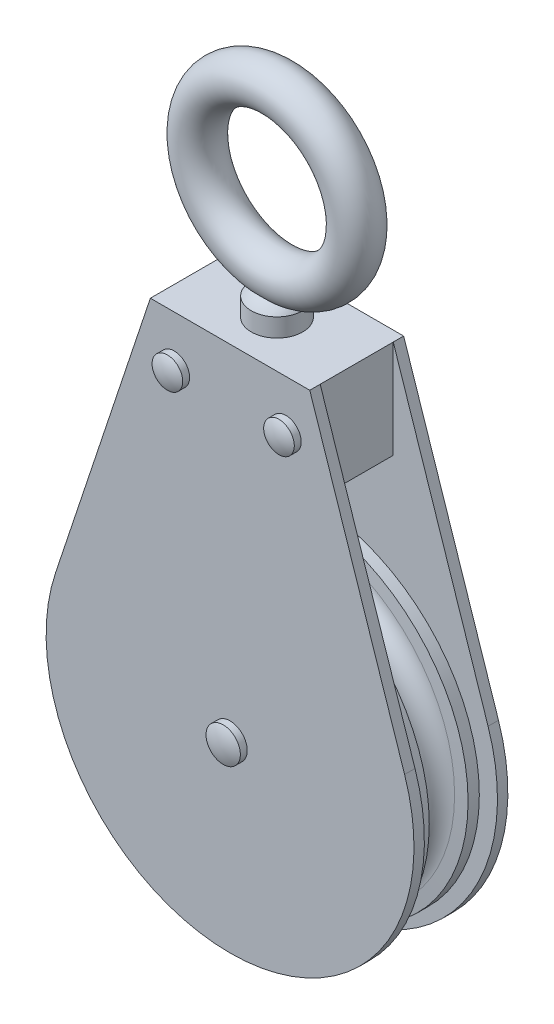
from build123d import *

# Parameters (mm, degrees)
SKETCH10_R          = 5.55625
BOSS_EXTRUDE1_DEPTH = 2.6924
SKETCH5_W           = 41.275
SKETCH5_H           = 25.4
BOSS_EXTRUDE2_DEPTH = 9.4615
SKETCH6_R           = 4.445
SKETCH6_R_2         = 3.96875
BOSS_EXTRUDE3_DEPTH = 1.778
DOME1_FACE_RADIUS   = 3.96875
DOME1_HEIGHT        = 1.016
DOME3_FACE_RADIUS   = 3.96875
DOME3_HEIGHT        = 1.016
DOME4_FACE_RADIUS   = 4.445
DOME4_HEIGHT        = 1.016
SKETCH8_R           = 5.55625
SKETCH8_R_2         = 7.9375
BOSS_EXTRUDE4_DEPTH = 1.778
DOME5_FACE_RADIUS   = 5.55625
DOME5_HEIGHT        = 2.54
DOME6_FACE_RADIUS   = 5.55625
DOME6_HEIGHT        = 2.54
DOME7_FACE_RADIUS   = 7.9375
DOME7_HEIGHT        = 3.9624
BOSS_EXTRUDE5_REACH = 158.53
SKETCH9_R           = 3.57505
SKETCH15_R          = 6.6675
BOSS_EXTRUDE6_DEPTH = 4.064
FILLET1_R           = 2.032


with BuildPart() as part:
    # Sketch3 → Revolve1 (revolve)
    with BuildSketch(Plane(origin=(0, 0, 0), x_dir=(0, 0, -1), z_dir=(1, 0, 0)), mode=Mode.PRIVATE) as revolve1_sk:
        with BuildLine():
            Line((-7.9375, 44.45), (-7.9375, 0))
            Line((-7.9375, 0), (7.9375, 0))
            Line((7.9375, 0), (7.9375, 44.45))
            Line((7.9375, 44.45), (5.025135302, 44.45))
            Line((5.025135302, 44.45), (4.74437725, 41.240920775))
            ThreePointArc((4.74437725, 41.240920775), (0, 36.8935), (-4.74437725, 41.240920775))
            Line((-4.74437725, 41.240920775), (-5.025135302, 44.45))
            Line((-5.025135302, 44.45), (-7.9375, 44.45))
        make_face()
    revolve(revolve1_sk.sketch.rotate(Axis((0, 0, 7.9375), (0, 0, -1)), 90), axis=Axis((0, 0, 7.9375), (0, 0, -1)))


with BuildPart() as body_2:
    # Sweep2: sweep along a path in Sketch11
    with BuildLine(Plane.XY) as sweep2_path:
        ThreePointArc((20.6375, 119.85625), (0, 140.49375), (-20.6375, 119.85625))
    # Sketch10 → Sweep2 (sweep)
    with BuildSketch(Plane(origin=(0, 119.85625, 0), x_dir=(-1, 0, 0), z_dir=(0, 1, 0))):
        with Locations((-20.6375, 0)):
            Circle(SKETCH10_R)
    sweep(path=sweep2_path.line)

    # Mirror7: body 2 across plane


with BuildPart() as body_2_1:
    add(body_2.part)
    add(body_2.part.mirror(Plane(origin=(20.6375, 119.85625, 0), x_dir=(0, 0, 1), z_dir=(0, 1, 0))))

    # Sketch14 → Revolve2 (revolve)
    with BuildSketch(Plane.XY, mode=Mode.PRIVATE) as revolve2_sk:
        with BuildLine():
            Line((6.6675, 88.9), (6.6675, 93.6625))
            ThreePointArc((6.6675, 93.6625), (3.813672998, 96.37844473), (0, 97.366666667))
            Line((0, 97.366666667), (0, 88.9))
            Line((0, 88.9), (6.6675, 88.9))
        make_face()
    revolve(revolve2_sk.sketch.rotate(Axis((0, 53.18125, 0), (0, 1, 0)), 90), axis=Axis((0, 53.18125, 0), (0, 1, 0)))


with BuildPart() as body_3:
    # Sketch4 → Boss-Extrude1 (new body)
    with BuildSketch(Plane.XY.offset(9.4615)):
        with BuildLine():
            Line((-20.6375, 88.9), (20.6375, 88.9))
            Line((20.6375, 88.9), (45.193815989, 15.021971288))
            ThreePointArc((45.193815989, 15.021971288), (0, -47.625), (-45.193815989, 15.021971288))
            Line((-45.193815989, 15.021971288), (-20.6375, 88.9))
        make_face()
    extrude(amount=BOSS_EXTRUDE1_DEPTH)

    # Sketch5 → Boss-Extrude2 (add)
    with BuildSketch(Plane(origin=(0, 0, 9.4615), x_dir=(-1, 0, 0), z_dir=(0, 0, -1))):
        with Locations((0, 76.2)):
            Rectangle(SKETCH5_W, SKETCH5_H)
    extrude(amount=BOSS_EXTRUDE2_DEPTH)

    # Mirror1: body 3 across plane


with BuildPart() as body_3_1:
    add(body_3.part)
    add(body_3.part.mirror(Plane.XY))

    # Sketch6 → Boss-Extrude3 (add)
    with BuildSketch(Plane.XY.offset(12.1539)):
        Circle(SKETCH6_R)
        with Locations((-14.44625, 76.2)):
            Circle(SKETCH6_R_2)
        with Locations((14.44625, 76.2)):
            Circle(SKETCH6_R_2)
    extrude(amount=BOSS_EXTRUDE3_DEPTH)

    # Dome1: a dome of height H over a round flat face of radius A is a cap of a sphere of radius (A * A + H * H) / (2 * H)
    dome1_r = (DOME1_FACE_RADIUS * DOME1_FACE_RADIUS + DOME1_HEIGHT * DOME1_HEIGHT) / (2 * DOME1_HEIGHT)
    dome1_base = Plane((-14.44625, 76.2, 13.9319), z_dir=(0, 0, 1))
    with Locations(dome1_base.offset(DOME1_HEIGHT - dome1_r)):
        dome1_ball = Sphere(dome1_r, mode=Mode.PRIVATE)
    add(split(dome1_ball, bisect_by=dome1_base, keep=Keep.TOP, mode=Mode.PRIVATE))

    # Dome3: a dome of height H over a round flat face of radius A is a cap of a sphere of radius (A * A + H * H) / (2 * H)
    dome3_r = (DOME3_FACE_RADIUS * DOME3_FACE_RADIUS + DOME3_HEIGHT * DOME3_HEIGHT) / (2 * DOME3_HEIGHT)
    dome3_base = Plane((14.44625, 76.2, 13.9319), z_dir=(0, 0, 1))
    with Locations(dome3_base.offset(DOME3_HEIGHT - dome3_r)):
        dome3_ball = Sphere(dome3_r, mode=Mode.PRIVATE)
    add(split(dome3_ball, bisect_by=dome3_base, keep=Keep.TOP, mode=Mode.PRIVATE))

    # Dome4: a dome of height H over a round flat face of radius A is a cap of a sphere of radius (A * A + H * H) / (2 * H)
    dome4_r = (DOME4_FACE_RADIUS * DOME4_FACE_RADIUS + DOME4_HEIGHT * DOME4_HEIGHT) / (2 * DOME4_HEIGHT)
    dome4_base = Plane((0, 0, 13.9319), z_dir=(0, 0, 1))
    with Locations(dome4_base.offset(DOME4_HEIGHT - dome4_r)):
        dome4_ball = Sphere(dome4_r, mode=Mode.PRIVATE)
    add(split(dome4_ball, bisect_by=dome4_base, keep=Keep.TOP, mode=Mode.PRIVATE))

    # Sketch8 → Boss-Extrude4 (add)
    with BuildSketch(Plane(origin=(0, 0, -12.1539), x_dir=(-1, 0, 0), z_dir=(0, 0, -1))):
        with Locations((-14.44625, 76.2)):
            Circle(SKETCH8_R)
        with Locations((14.44625, 76.2)):
            Circle(SKETCH8_R)
        Circle(SKETCH8_R_2)
    extrude(amount=BOSS_EXTRUDE4_DEPTH)

    # Dome5: a dome of height H over a round flat face of radius A is a cap of a sphere of radius (A * A + H * H) / (2 * H)
    dome5_r = (DOME5_FACE_RADIUS * DOME5_FACE_RADIUS + DOME5_HEIGHT * DOME5_HEIGHT) / (2 * DOME5_HEIGHT)
    dome5_base = Plane((14.44625, 76.2, -13.9319), z_dir=(0, 0, -1))
    with Locations(dome5_base.offset(DOME5_HEIGHT - dome5_r)):
        dome5_ball = Sphere(dome5_r, mode=Mode.PRIVATE)
    add(split(dome5_ball, bisect_by=dome5_base, keep=Keep.TOP, mode=Mode.PRIVATE))

    # Dome6: a dome of height H over a round flat face of radius A is a cap of a sphere of radius (A * A + H * H) / (2 * H)
    dome6_r = (DOME6_FACE_RADIUS * DOME6_FACE_RADIUS + DOME6_HEIGHT * DOME6_HEIGHT) / (2 * DOME6_HEIGHT)
    dome6_base = Plane((-14.44625, 76.2, -13.9319), z_dir=(0, 0, -1))
    with Locations(dome6_base.offset(DOME6_HEIGHT - dome6_r)):
        dome6_ball = Sphere(dome6_r, mode=Mode.PRIVATE)
    add(split(dome6_ball, bisect_by=dome6_base, keep=Keep.TOP, mode=Mode.PRIVATE))

    # Dome7: a dome of height H over a round flat face of radius A is a cap of a sphere of radius (A * A + H * H) / (2 * H)
    dome7_r = (DOME7_FACE_RADIUS * DOME7_FACE_RADIUS + DOME7_HEIGHT * DOME7_HEIGHT) / (2 * DOME7_HEIGHT)
    dome7_base = Plane((0, 0, -13.9319), z_dir=(0, 0, -1))
    with Locations(dome7_base.offset(DOME7_HEIGHT - dome7_r)):
        dome7_ball = Sphere(dome7_r, mode=Mode.PRIVATE)
    add(split(dome7_ball, bisect_by=dome7_base, keep=Keep.TOP, mode=Mode.PRIVATE))

    # Boss-Extrude5: up to this face of the body (flat: up to its plane)
    boss_extrude5_end = Plane(body_3_1.part.faces().sort_by_distance((0, 16.31740649, -12.1539))[0])
    # Sketch9 → Boss-Extrude5 (add, up to the picked face)
    with BuildSketch(Plane.XY.offset(12.1539), mode=Mode.PRIVATE) as boss_extrude5_sk1:
        Circle(SKETCH9_R)
    boss_extrude5_tool1 = split(extrude(boss_extrude5_sk1.sketch, amount=-BOSS_EXTRUDE5_REACH, mode=Mode.PRIVATE), bisect_by=boss_extrude5_end, keep=Keep.BOTH, mode=Mode.PRIVATE)

    add(part.part)  # Boss-Extrude5 merges part
    add(boss_extrude5_tool1.solids().sort_by(Axis((0, 0, 12.1539), (0, 0, -1)))[0])

    # Combine1: union body 2
    add(body_2_1.part)

    # Sketch15 → Boss-Extrude6 (add)
    with BuildSketch(Plane.XZ.offset(-63.5)):
        with Locations(Location((0, 0, 0), (0, 0, 270))):
            Circle(SKETCH15_R)
    extrude(amount=BOSS_EXTRUDE6_DEPTH)

    # Fillet1
    fillet1_edges = [body_3_1.edges().sort_by_distance(p)[0] for p in [
        (0, 59.436, 6.6675),
    ]]
    fillet(fillet1_edges, radius=FILLET1_R)


solid = body_3_1.part
